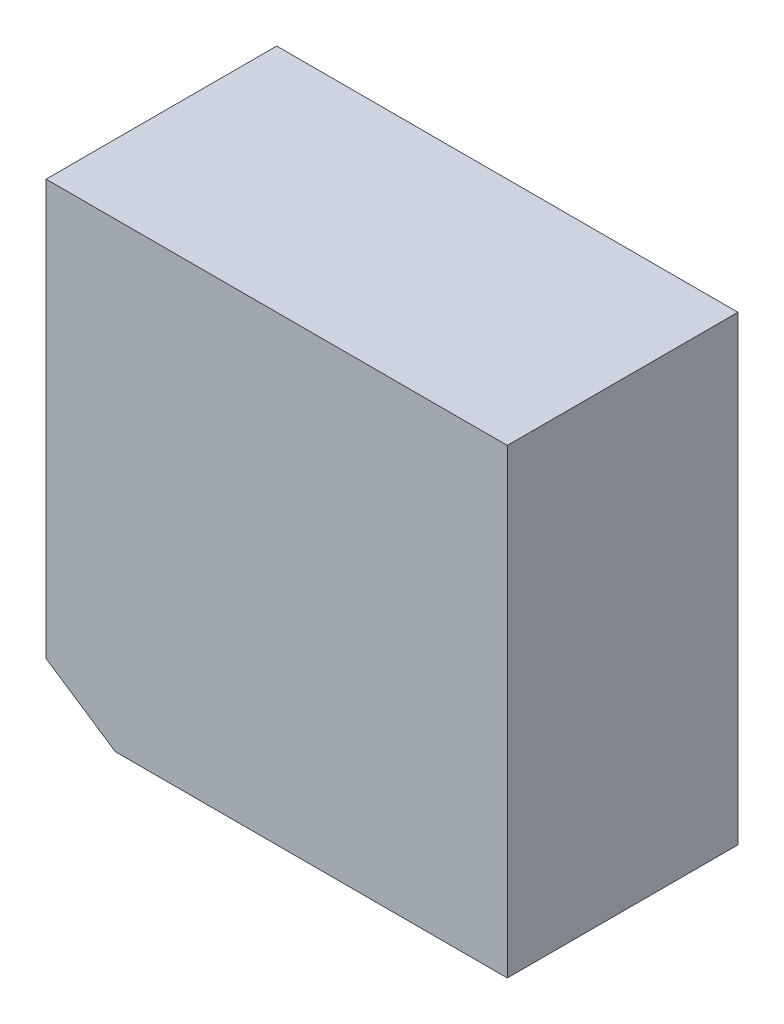
from build123d import *

# Parameters (mm, degrees)
SKETCH_1_W                    = 20
SKETCH_1_H                    = 20
BASEBOX_DEPTH                 = 10
CHAMFERDISTANCEDISTANCE_SIZE  = 2
CHAMFERDISTANCEDISTANCE_SIZE2 = 3


with BuildPart() as part:
    # 草图1 → BaseBox (new body)
    with BuildSketch(Plane.XY):
        with Locations((10, 10)):
            Rectangle(SKETCH_1_W, SKETCH_1_H)
    extrude(amount=BASEBOX_DEPTH)

    # ChamferDistanceDistance
    chamferdistancedistance_edges = [part.edges().sort_by_distance(p)[0] for p in [
        (0, 0, 5),
    ]]
    chamferdistancedistance_side = [part.faces().sort_by_distance(p)[0] for p in [
        (0, 10, 5),
    ]]
    chamfer(chamferdistancedistance_edges, length=CHAMFERDISTANCEDISTANCE_SIZE, length2=CHAMFERDISTANCEDISTANCE_SIZE2, reference=chamferdistancedistance_side[0])


solid = part.part
